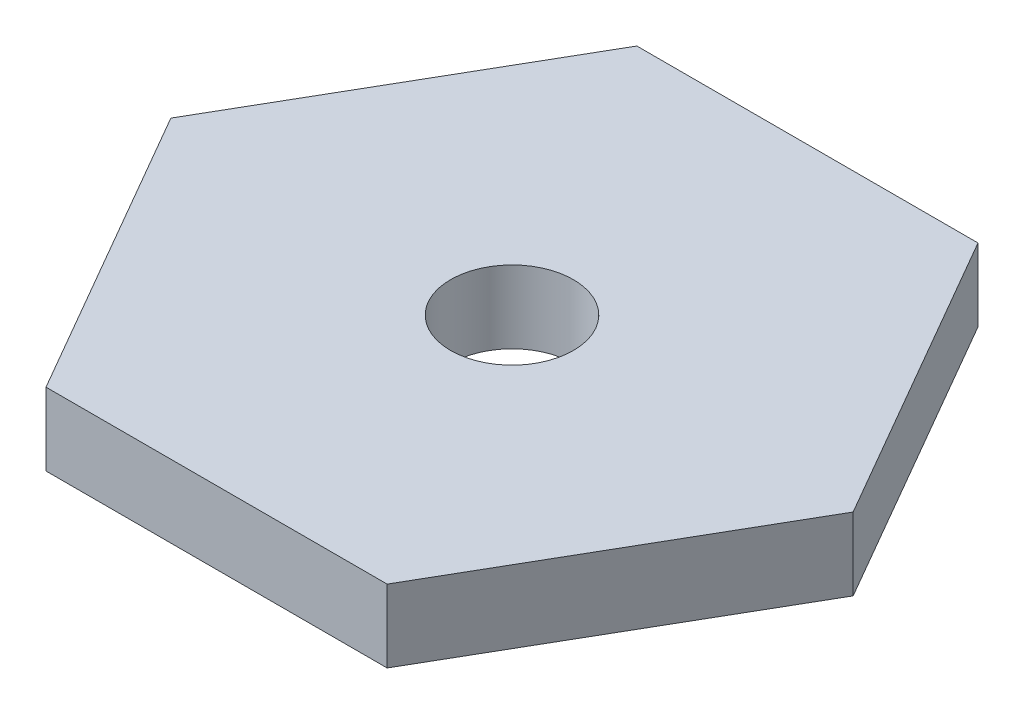
from build123d import *

# Parameters (mm, degrees)
BOSS_EXTRUDE1_DEPTH = 11.27
SKETCH2_R           = 9.525
CUT_EXTRUDE1_DEPTH  = 71.900289315


with BuildPart() as part:
    # Sketch1 → Boss-Extrude1 (new body)
    with BuildSketch(Plane(origin=(0, 0, 0), x_dir=(1, 0, 0), z_dir=(0, 1, 0))):
        Polygon((26.457076086, 45.825), (-26.457076086, 45.825), (-52.914152171, 0), (-26.457076086, -45.825), (26.457076086, -45.825), (52.914152171, 0), align=None)
    extrude(amount=BOSS_EXTRUDE1_DEPTH)

    # Sketch2 → Cut-Extrude1 (cut, through all)
    with BuildSketch(Plane(origin=(0, 11.27, 0), x_dir=(1, 0, 0), z_dir=(0, 1, 0))):
        with Locations(Location((0, 0, 0), (0, 0, 270))):
            Circle(SKETCH2_R)
    extrude(amount=-CUT_EXTRUDE1_DEPTH, mode=Mode.SUBTRACT)


solid = part.part
